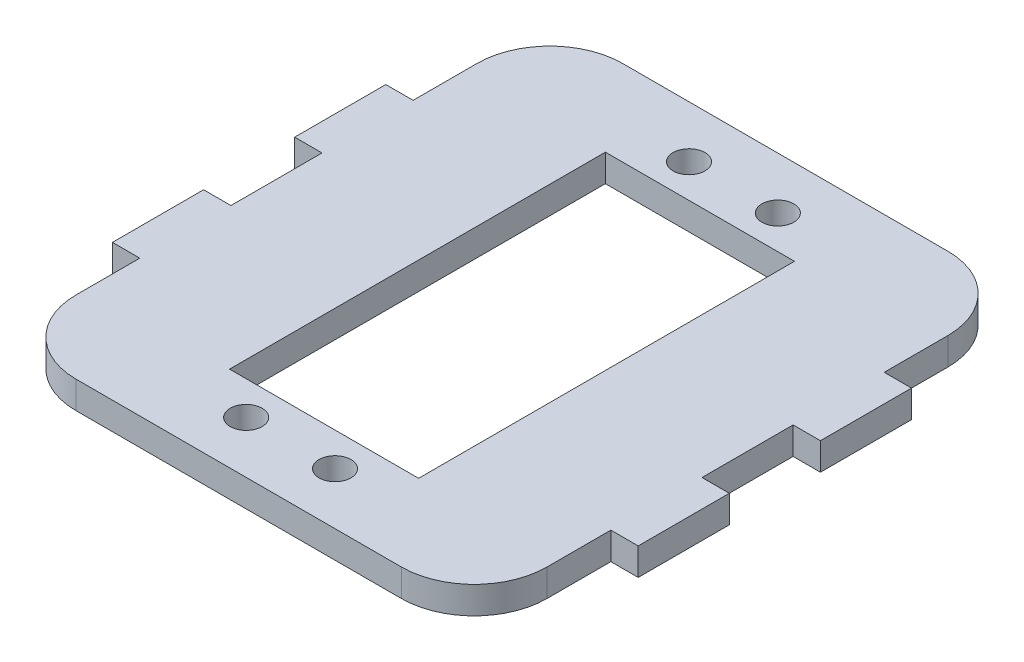
from build123d import *

# Parameters (mm, degrees)
SKETCH_1_R      = 1.75
SKETCH_1_W      = 20.75
SKETCH_1_H      = 41.25
EXTRUDE_1_DEPTH = 3
FILLET_1_R      = 8


with BuildPart() as part:
    # 草图1 → 凸台-拉伸1 (new body)
    with BuildSketch(Plane(origin=(0, 0, 0), x_dir=(1, 0, 0), z_dir=(0, 1, 0))):
        Polygon((25.85, -30), (-25.85, -30), (-25.85, -15), (-28.85, -15), (-28.85, -5), (-25.85, -5), (-25.85, 5), (-28.85, 5), (-28.85, 15), (-25.85, 15), (-25.85, 30), (25.85, 30), (25.85, 15), (28.85, 15), (28.85, 5), (25.85, 5), (25.85, -5), (28.85, -5), (28.85, -15), (25.85, -15), align=None)
        with Locations(Location((-4.875, -24.3, 0), (0, 0, 270))):
            Circle(SKETCH_1_R, mode=Mode.SUBTRACT)
        with Locations(Location((4.875, -24.3, 0), (0, 0, 90))):
            Circle(SKETCH_1_R, mode=Mode.SUBTRACT)
        with Locations(Location((4.875, 24.3, 0), (0, 0, 270))):
            Circle(SKETCH_1_R, mode=Mode.SUBTRACT)
        with Locations(Location((-4.875, 24.3, 0), (0, 0, 90))):
            Circle(SKETCH_1_R, mode=Mode.SUBTRACT)
        Rectangle(SKETCH_1_W, SKETCH_1_H, mode=Mode.SUBTRACT)
    extrude(amount=EXTRUDE_1_DEPTH)

    # 圆角1
    fillet_1_edges = [part.edges().sort_by_distance(p)[0] for p in [
        (-25.85, 1.5, -30),
        (25.85, 1.5, -30),
        (25.85, 1.5, 30),
        (-25.85, 1.5, 30),
    ]]
    fillet(fillet_1_edges, radius=FILLET_1_R)


solid = part.part
